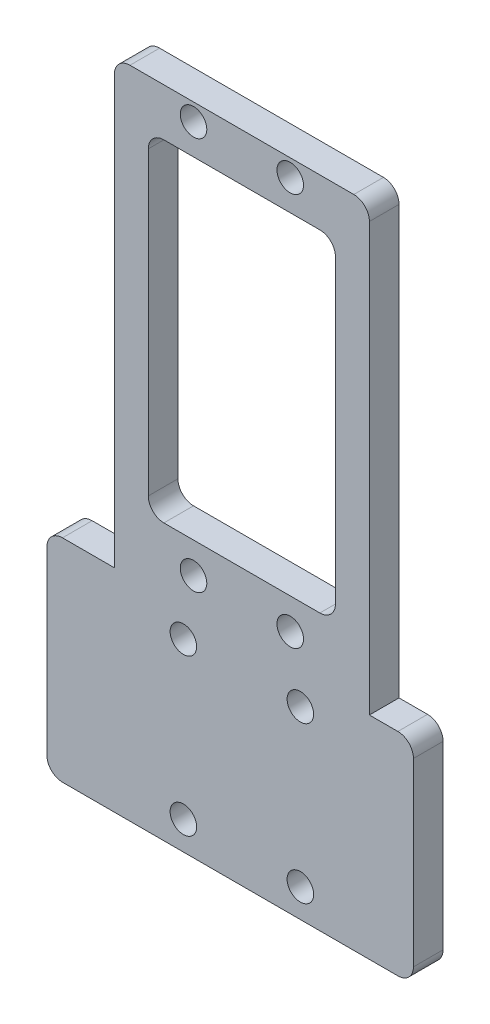
from build123d import *

# Parameters (mm, degrees)
SKETCH1_R           = 1.7
BOSS_EXTRUDE1_DEPTH = 3.8


with BuildPart() as part:
    # Sketch1 → Boss-Extrude1 (new body)
    with BuildSketch(Plane.XY):
        with BuildLine():
            Line((3.000019473, 70.3), (31.700019473, 70.3))
            ThreePointArc((31.700019473, 70.3), (33.114233035, 69.714213562), (33.700019473, 68.3))
            Line((33.700019473, 68.3), (33.700019473, 13.5))
            Line((33.700019473, 13.5), (37.350019473, 13.5))
            ThreePointArc((37.350019473, 13.5), (38.764233035, 12.914213562), (39.350019473, 11.5))
            Line((39.350019473, 11.5), (39.350019473, -11.641128199))
            ThreePointArc((39.350019473, -11.641128199), (38.764233035, -13.055341761), (37.350019473, -13.641128199))
            Line((37.350019473, -13.641128199), (31.700019473, -13.641128199))
            Line((31.700019473, -13.641128199), (3.000019473, -13.641128199))
            Line((3.000019473, -13.641128199), (-5.649980527, -13.641128199))
            ThreePointArc((-5.649980527, -13.641128199), (-7.064194089, -13.055341761), (-7.649980527, -11.641128199))
            Line((-7.649980527, -11.641128199), (-7.649980527, 11.5))
            ThreePointArc((-7.649980527, 11.5), (-7.064194089, 12.914213562), (-5.649980527, 13.5))
            Line((-5.649980527, 13.5), (1.000019473, 13.5))
            Line((1.000019473, 13.5), (1.000019473, 68.3))
            ThreePointArc((1.000019473, 68.3), (1.585805911, 69.714213562), (3.000019473, 70.3))
        make_face()
        with Locations(Location((11.15, 17.7, 0), (0, 0, 180))):
            Circle(SKETCH1_R, mode=Mode.SUBTRACT)
        with Locations(Location((9.85, 10, 0), (0, 0, 180))):
            Circle(SKETCH1_R, mode=Mode.SUBTRACT)
        with Locations(Location((24.85, 10, 0), (0, 0, 180))):
            Circle(SKETCH1_R, mode=Mode.SUBTRACT)
        with Locations(Location((9.85, -10, 0), (0, 0, 180))):
            Circle(SKETCH1_R, mode=Mode.SUBTRACT)
        with Locations(Location((24.85, -10, 0), (0, 0, 180))):
            Circle(SKETCH1_R, mode=Mode.SUBTRACT)
        with Locations(Location((23.55, 17.7, 0), (0, 0, 180))):
            Circle(SKETCH1_R, mode=Mode.SUBTRACT)
        with Locations(Location((23.55, 68.1, 0), (0, 0, 180))):
            Circle(SKETCH1_R, mode=Mode.SUBTRACT)
        with Locations(Location((11.15, 68.1, 0), (0, 0, 180))):
            Circle(SKETCH1_R, mode=Mode.SUBTRACT)
        with BuildLine():
            Line((7.35, 64.190811085), (27.35, 64.190811085))
            ThreePointArc((27.35, 64.190811085), (28.764213562, 63.605024648), (29.35, 62.190811085))
            Line((29.35, 62.190811085), (29.35, 23.654008347))
            ThreePointArc((29.35, 23.654008347), (28.764213562, 22.239794784), (27.35, 21.654008347))
            Line((27.35, 21.654008347), (7.35, 21.654008347))
            ThreePointArc((7.35, 21.654008347), (5.935786438, 22.239794784), (5.35, 23.654008347))
            Line((5.35, 23.654008347), (5.35, 62.190811085))
            ThreePointArc((5.35, 62.190811085), (5.935786438, 63.605024648), (7.35, 64.190811085))
        make_face(mode=Mode.SUBTRACT)
    extrude(amount=BOSS_EXTRUDE1_DEPTH)


solid = part.part
